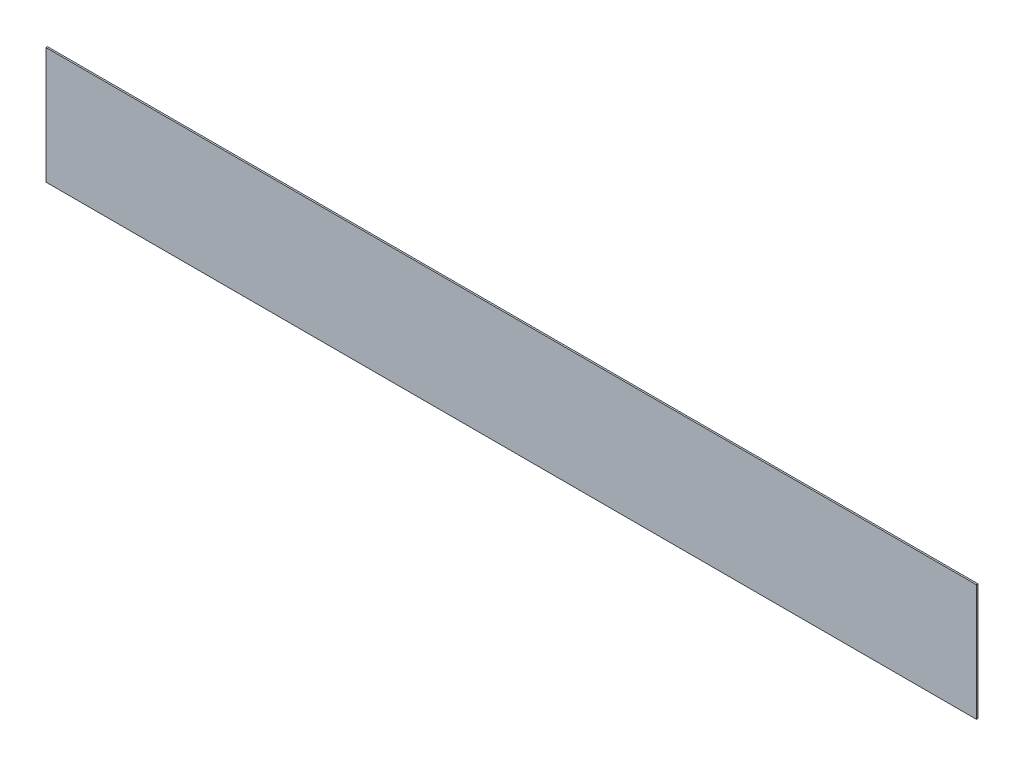
from build123d import *

# Parameters (mm, degrees)
CEK_DONMUS_KUTU_ARKA_1_0_1_START = -699
SKETCH1_W                        = 590.6
SKETCH1_H                        = 74
CEK_DONMUS_KUTU_ARKA_1_0_1_DEPTH = 1


with BuildPart() as part:
    # Sketch1 → CEK_donmus_kutu_arka_1.0_1 (new body)
    with BuildSketch(Plane.XY.offset(CEK_DONMUS_KUTU_ARKA_1_0_1_START)):
        with Locations((309, 45)):
            Rectangle(SKETCH1_W, SKETCH1_H)
    extrude(amount=-CEK_DONMUS_KUTU_ARKA_1_0_1_DEPTH)


solid = part.part
